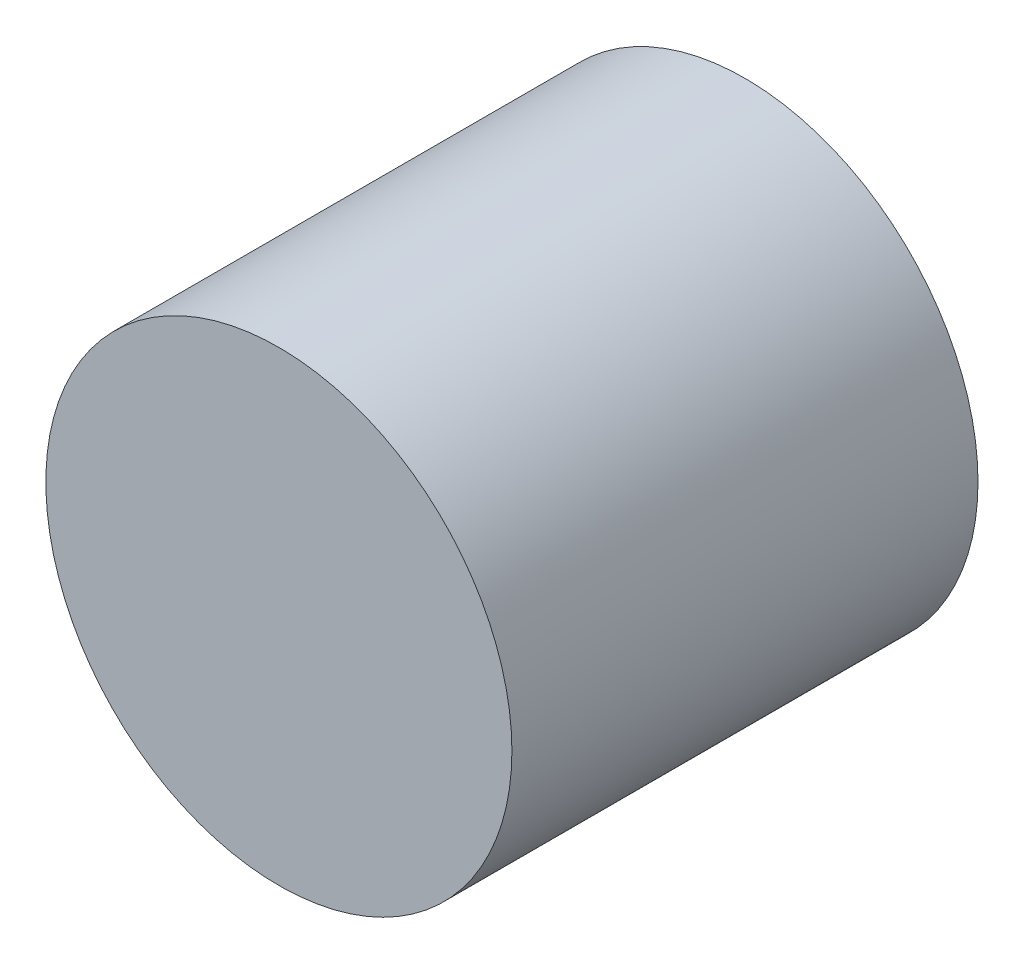
from build123d import *

# Parameters (mm, degrees)
SKETCH3_R           = 125
BOSS_EXTRUDE1_DEPTH = 250


with BuildPart() as part:
    # Sketch3 → Boss-Extrude1 (new body)
    with BuildSketch(Plane.XY):
        Circle(SKETCH3_R)
    extrude(amount=BOSS_EXTRUDE1_DEPTH)


solid = part.part
